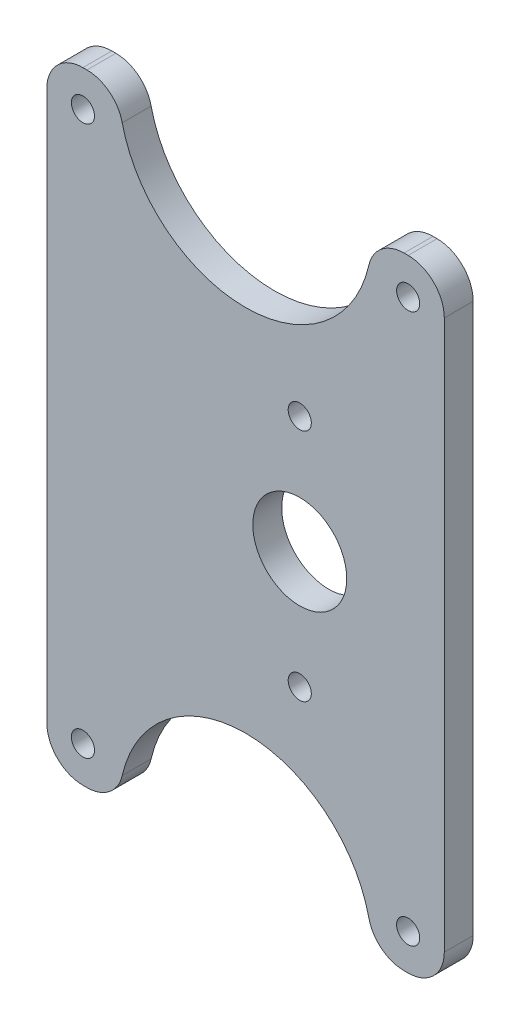
from build123d import *

# Parameters (mm, degrees)
SKETCH_1_W          = 55
SKETCH_1_H          = 86
EXTRUDE_1_DEPTH     = 2
SKETCH_2_R          = 6.5
CUT_EXTRUDE_1_DEPTH = 52.198144498
SKETCH_3_R          = 1.6
CUT_EXTRUDE_2_DEPTH = 52.198144498
SKETCH_4_R          = 1.6
CUT_EXTRUDE_3_DEPTH = 52.198144498
SKETCH_7_R          = 17.5
CUT_EXTRUDE_6_DEPTH = 52.198144498
FILLET_2_R          = 5


with BuildPart() as part:
    # ｽｹｯﾁ1 → ﾎﾞｽ - 押し出し1 (new, symmetric)
    with BuildSketch(Plane.XY):
        Rectangle(SKETCH_1_W, SKETCH_1_H)
    extrude(amount=EXTRUDE_1_DEPTH, both=True)

    # ｽｹｯﾁ2 → ｶｯﾄ - 押し出し1 (cut, through all)
    with BuildSketch(Plane.XY.offset(2)):
        with Locations((7.5, 0)):
            Circle(SKETCH_2_R)
    extrude(amount=-CUT_EXTRUDE_1_DEPTH, mode=Mode.SUBTRACT)

    # ｽｹｯﾁ3 → ｶｯﾄ - 押し出し2 (cut, through all)
    with BuildSketch(Plane.XY.offset(2)):
        with Locations((-22.5, 38)):
            Circle(SKETCH_3_R)
        with Locations(Location((22.5, 38, 0), (0, 0, 180))):
            Circle(SKETCH_3_R)
        with Locations((22.5, -38)):
            Circle(SKETCH_3_R)
        with Locations(Location((-22.5, -38, 0), (0, 0, 180))):
            Circle(SKETCH_3_R)
    extrude(amount=-CUT_EXTRUDE_2_DEPTH, mode=Mode.SUBTRACT)

    # ｽｹｯﾁ4 → ｶｯﾄ - 押し出し3 (cut, through all)
    with BuildSketch(Plane(origin=(0, 0, -2), x_dir=(-1, 0, 0), z_dir=(0, 0, -1))):
        with Locations((-7.5, 16.215)):
            Circle(SKETCH_4_R)
        with Locations((-7.5, -16.215)):
            Circle(SKETCH_4_R)
    extrude(amount=-CUT_EXTRUDE_3_DEPTH, mode=Mode.SUBTRACT)

    # ｽｹｯﾁ7 → ｶｯﾄ - 押し出し6 (cut, through all)
    with BuildSketch(Plane.XY.offset(2)):
        with Locations((0, 43)):
            Circle(SKETCH_7_R)
        with Locations((0, -43)):
            Circle(SKETCH_7_R)
    extrude(amount=-CUT_EXTRUDE_6_DEPTH, mode=Mode.SUBTRACT)

    # ﾌｨﾚｯﾄ2
    fillet_2_edges = [part.edges().sort_by_distance(p)[0] for p in [
        (17.5, 43, 0),
        (-17.5, 43, 0),
        (-17.5, -43, 0),
        (17.5, -43, 0),
        (27.5, -43, 0),
        (-27.5, -43, 0),
        (-27.5, 43, 0),
        (27.5, 43, 0),
    ]]
    fillet(fillet_2_edges, radius=FILLET_2_R)


solid = part.part
